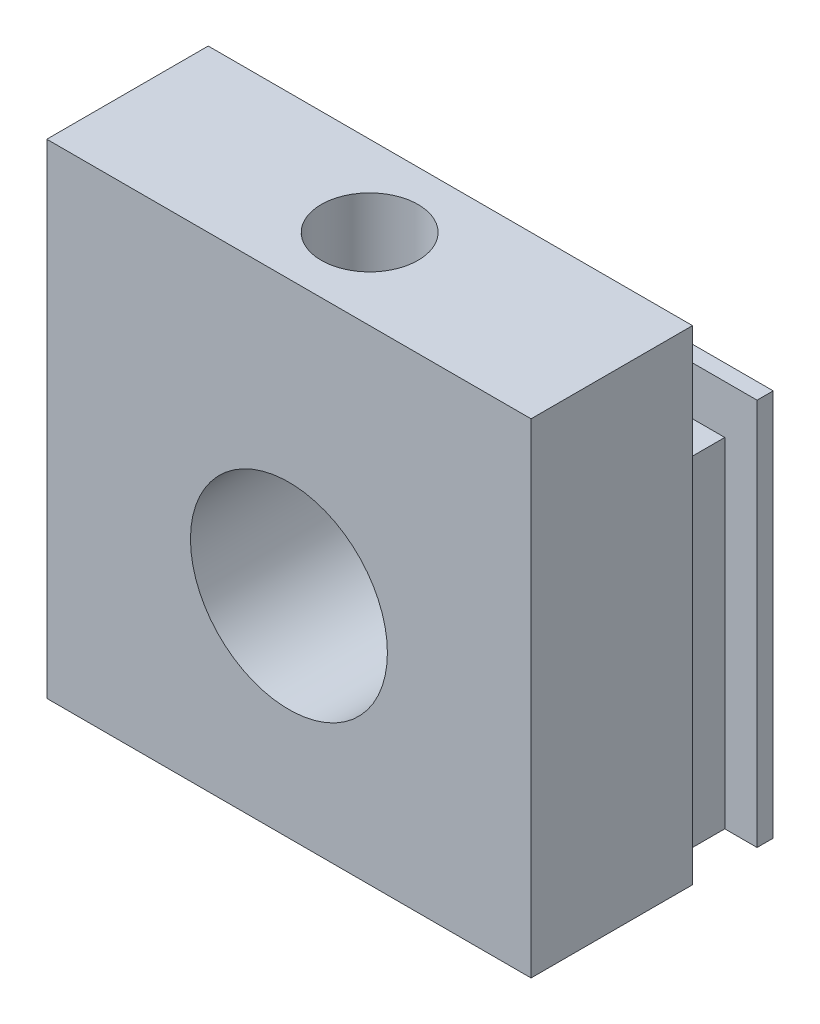
from build123d import *

# Parameters (mm, degrees)
ESQUISSE1_W             = 15
ESQUISSE1_H             = 15
BOSS_EXTRU_1_DEPTH      = 5
ESQUISSE2_R             = 1.5
ENL_V_MAT_EXTRU_1_DEPTH = 3
ESQUISSE3_W             = 13
ESQUISSE3_H             = 10.5
BOSS_EXTRU_2_DEPTH      = 2
ESQUISSE4_W             = 15
ESQUISSE4_H             = 12
BOSS_EXTRU_3_DEPTH      = 0.5
ESQUISSE5_R             = 3.05
ENL_V_MAT_EXTRU_2_DEPTH = 1
ESQUISSE5_3_R           = 3.05
ENL_V_MAT_EXTRU_3_DEPTH = 15


with BuildPart() as part:
    # Esquisse1 → Boss.-Extru.1 (new body)
    with BuildSketch(Plane.XY):
        Rectangle(ESQUISSE1_W, ESQUISSE1_H)
    extrude(amount=BOSS_EXTRU_1_DEPTH)

    # Esquisse2 → Enlèv. mat.-Extru.1 (cut)
    with BuildSketch(Plane(origin=(0, 7.5, 0), x_dir=(1, 0, 0), z_dir=(0, 1, 0))):
        with Locations((0, -2.5)):
            Circle(ESQUISSE2_R)
    extrude(amount=-ENL_V_MAT_EXTRU_1_DEPTH, mode=Mode.SUBTRACT)

    # Esquisse3 → Boss.-Extru.2 (add)
    with BuildSketch(Plane(origin=(0, 0, 0), x_dir=(-1, 0, 0), z_dir=(0, 0, -1))):
        with Locations((0, -2.25)):
            Rectangle(ESQUISSE3_W, ESQUISSE3_H)
    extrude(amount=BOSS_EXTRU_2_DEPTH)

    # Esquisse4 → Boss.-Extru.3 (add)
    with BuildSketch(Plane(origin=(0, 0, -2), x_dir=(-1, 0, 0), z_dir=(0, 0, -1))):
        with Locations((0, -1.5)):
            Rectangle(ESQUISSE4_W, ESQUISSE4_H)
    extrude(amount=BOSS_EXTRU_3_DEPTH)

    # Esquisse5 → Enlèv. mat.-Extru.2 (cut)
    with BuildSketch(Plane(origin=(0, 0, -2.5), x_dir=(-1, 0, 0), z_dir=(0, 0, -1))):
        with Locations((0, -1)):
            Circle(ESQUISSE5_R)
    extrude(amount=-ENL_V_MAT_EXTRU_2_DEPTH, mode=Mode.SUBTRACT)

    # Esquisse5<3> → Enlèv. mat.-Extru.3 (cut)
    with BuildSketch(Plane(origin=(0, 0, -2.5), x_dir=(-1, 0, 0), z_dir=(0, 0, -1))):
        with Locations((0, -1)):
            Circle(ESQUISSE5_3_R)
    extrude(amount=-ENL_V_MAT_EXTRU_3_DEPTH, mode=Mode.SUBTRACT)


solid = part.part
